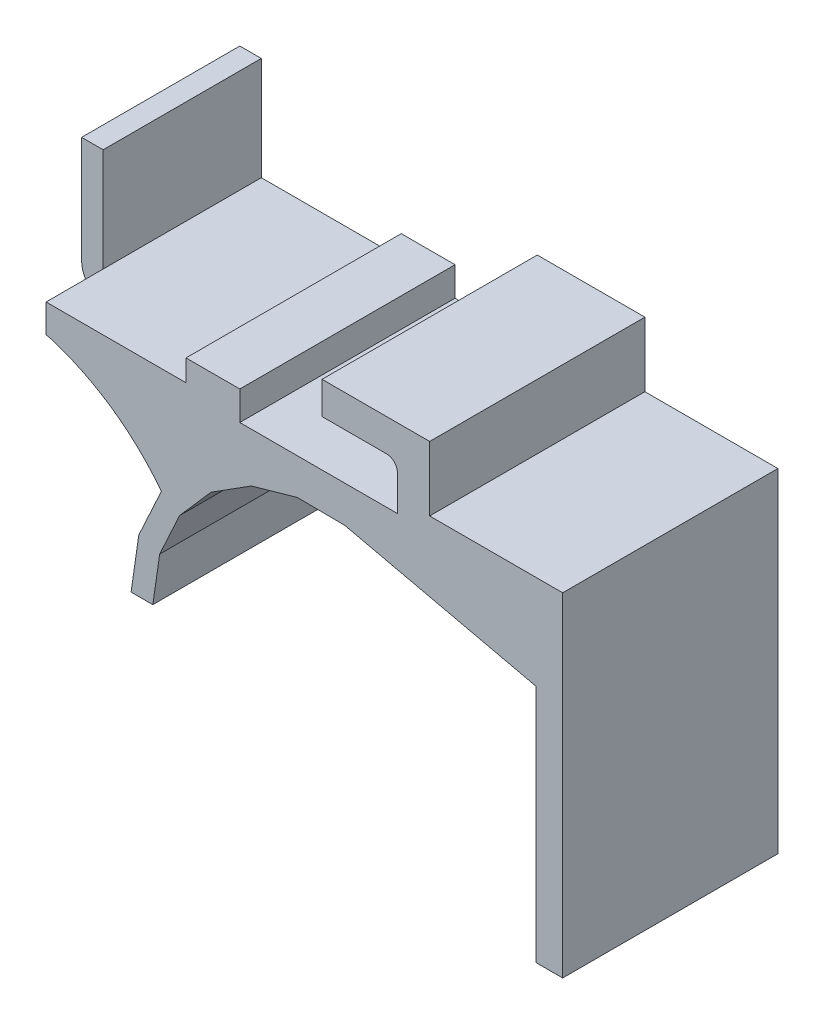
from build123d import *

# Parameters (mm, degrees)
SALIENTE_EXTRUIR1_DEPTH = 20
CORTAR_EXTRUIR2_DEPTH   = 5.3


with BuildPart() as part:
    # Croquis3 → Saliente-Extruir1 (new body)
    with BuildSketch(Plane.XY):
        with BuildLine():
            Line((-51.952746953, -11.691023914), (-51.874375972, -12.286308051))
            Line((-51.874375972, -12.286308051), (-51.644609193, -12.841022845))
            Line((-51.644609193, -12.841022845), (-51.279094792, -13.317369615))
            Line((-51.279094792, -13.317369615), (-50.802748021, -13.68288106))
            Line((-50.802748021, -13.68288106), (-50.24803027, -13.912653752))
            Line((-50.24803027, -13.912653752), (-49.65250662, -13.99148306))
            Line((-49.65250662, -13.99148306), (-48.634298914, -14.325284182))
            Line((-48.634298914, -14.325284182), (-47.63492106, -14.711825449))
            Line((-47.63492106, -14.711825449), (-46.657105279, -15.15005123))
            Line((-46.657105279, -15.15005123), (-45.70351874, -15.638763962))
            Line((-45.70351874, -15.638763962), (-44.776769471, -16.17663006))
            Line((-44.776769471, -16.17663006), (-43.879382708, -16.762176963))
            Line((-43.879382708, -16.762176963), (-43.013812718, -17.393807919))
            Line((-43.013812718, -17.393807919), (-42.182430974, -18.069799027))
            Line((-42.182430974, -18.069799027), (-41.387496586, -18.788302193))
            Line((-41.387496586, -18.788302193), (-40.631179954, -19.547354003))
            Line((-40.631179954, -19.547354003), (-39.91556277, -20.344881636))
            Line((-39.91556277, -20.344881636), (-39.24257888, -21.178708777))
            Line((-39.24257888, -21.178708777), (-41.33719888, -25.732864397))
            Line((-41.33719888, -25.732864397), (-42.055027862, -30.693958319))
            Line((-42.055027862, -30.693958319), (-40.034201485, -30.693958319))
            Line((-40.034201485, -30.693958319), (-39.399249875, -26.305668328))
            Line((-39.399249875, -26.305668328), (-37.546478747, -22.277332194))
            Line((-37.546478747, -22.277332194), (-34.627863462, -18.93937864))
            Line((-34.627863462, -18.93937864), (-30.882804538, -16.565607853))
            Line((-30.882804538, -16.565607853), (-26.81051779, -15.405439974))
            Line((-26.81051779, -15.405439974), (-26.618493511, -15.3507305))
            Line((-26.618493511, -15.3507305), (-22.195772803, -15.394292275))
            Line((-22.195772803, -15.394292275), (-4.431072692, -19.454792623))
            Line((-4.431072692, -19.454792623), (-4.431072692, -41.693958205))
            Line((-4.431072692, -41.693958205), (-1.951072692, -41.693958205))
            Line((-1.951072692, -41.693958205), (-1.951072692, -10.693958394))
            Line((-1.951072692, -10.693958394), (-14.311475216, -10.693958394))
            Line((-14.311475216, -10.693958394), (-14.311475216, -4.693956642))
            Line((-14.311475216, -4.693956642), (-24.311475179, -4.693956642))
            Line((-24.311475179, -4.693956642), (-24.311475179, -7.693958997))
            Line((-24.311475179, -7.693958997), (-18.31147047, -7.693958997))
            ThreePointArc((-18.31147047, -7.693958997), (-17.604362437, -7.986851509), (-17.311465743, -8.69395781))
            Line((-17.311465743, -8.69395781), (-17.311465743, -11.993957443))
            Line((-17.311465743, -11.993957443), (-31.952510471, -11.993957443))
            Line((-31.952510471, -11.993957443), (-31.952510471, -9.293958281))
            Line((-31.952510471, -9.293958281), (-36.952504539, -9.293958281))
            Line((-36.952504539, -9.293958281), (-36.952504539, -11.293958865))
            Line((-36.952504539, -11.293958865), (-49.952506856, -11.293958865))
            Line((-49.952506856, -11.293958865), (-49.952506856, -1.693957245))
            Line((-49.952506856, -1.693957245), (-51.951481378, -1.69383601))
            Line((-51.951481378, -1.69383601), (-51.952746953, -11.691023914))
        make_face()
    extrude(amount=SALIENTE_EXTRUIR1_DEPTH)

    # Croquis5 → Cortar-Extruir2 (cut)
    with BuildSketch(Plane.XY.offset(20)):
        Polygon((-49.952506856, -11.293958865), (-49.950268445, -13.952068406), (-50.24803027, -13.912653752), (-50.802748021, -13.68288106), (-51.279094792, -13.317369615), (-51.644609193, -12.841022845), (-51.874375972, -12.286308051), (-51.952746953, -11.691023914), (-51.951481378, -1.69383601), (-49.952506856, -1.693957245), align=None)
    extrude(amount=-CORTAR_EXTRUIR2_DEPTH, mode=Mode.SUBTRACT)


solid = part.part
